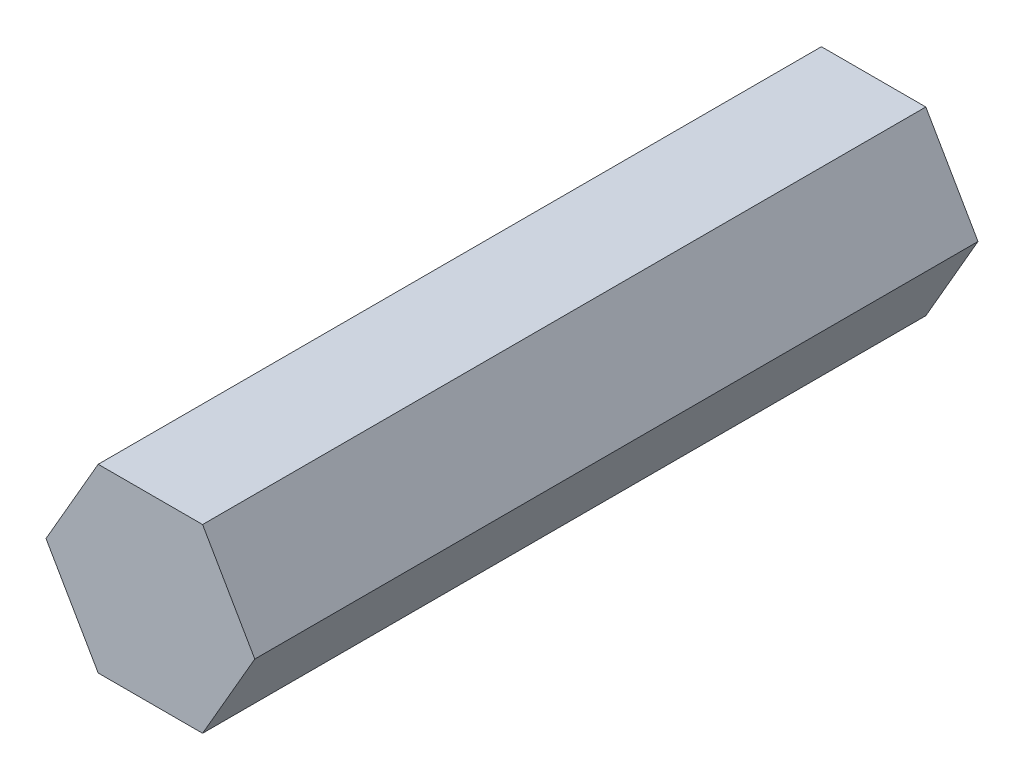
from build123d import *

# Parameters (mm, degrees)
BOSS_EXTRUDE1_DEPTH = 50.8


with BuildPart() as part:
    # Sketch1 → Boss-Extrude1 (new body)
    with BuildSketch(Plane.XY):
        Polygon((7.332348419, 0), (3.666174209, 6.35), (-3.666174209, 6.35), (-7.332348419, 0), (-3.666174209, -6.35), (3.666174209, -6.35), align=None)
    extrude(amount=BOSS_EXTRUDE1_DEPTH)


solid = part.part
